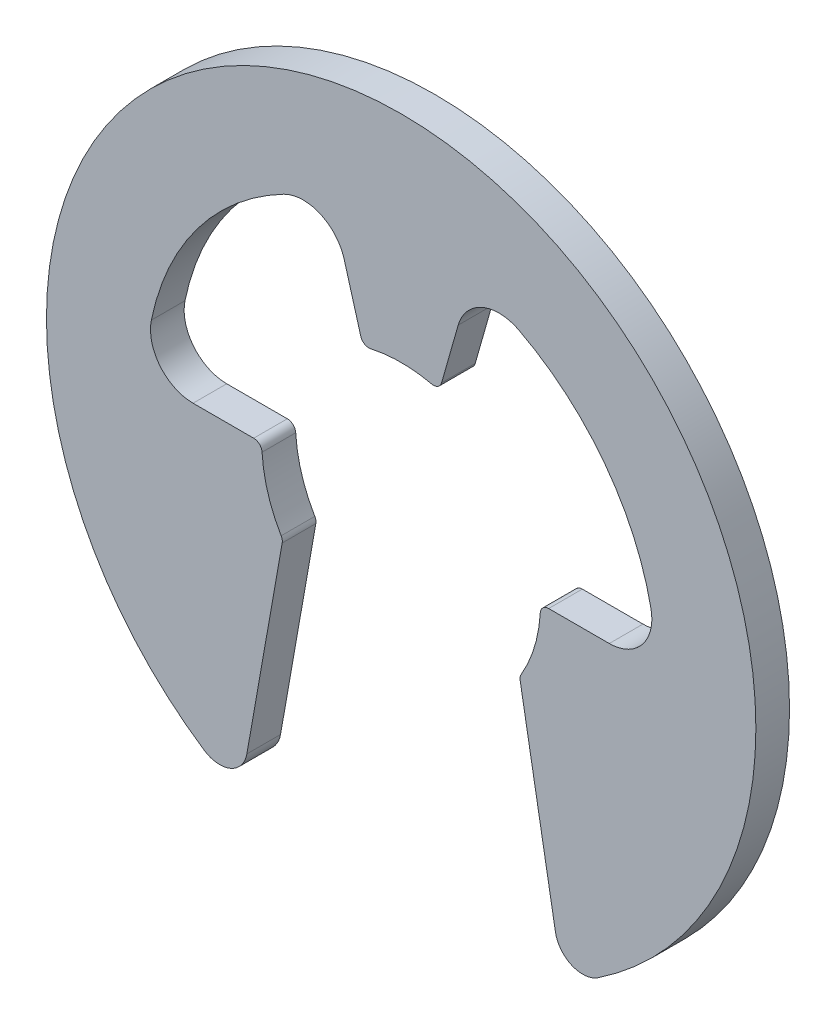
from build123d import *

# Parameters (mm, degrees)
SKETCH3_W               = 6.6929
SKETCH3_H               = 0.635
CUT_EXTRUDE1_DEPTH      = 10.470513559
CUT_EXTRUDE1_DEPTH_BACK = 10.470513559
FILLET1_R               = 0.803148
FILLET2_R               = 0.5220462
FILLET3_R               = 0.15875


with BuildPart() as part:
    # Sketch3 → Revolve1 (revolve)
    with BuildSketch(Plane(origin=(0, 0, 0), x_dir=(1, 0, 0), z_dir=(0, 1, 0))):
        with Locations((-3.34645, 0)):
            Rectangle(SKETCH3_W, SKETCH3_H)
    revolve(axis=Axis((0, 0, -0.3175), (0, 0, 1)))

    # Sketch4 → Cut-Extrude1 (cut, two sides: drawn at the far end of the back side and taken through both)
    with BuildSketch(Plane.XY.offset(-CUT_EXTRUDE1_DEPTH_BACK)):
        with BuildLine():
            Line((0.719953916, 2.528395058), (1.317615519, 4.62731363))
            ThreePointArc((1.317615519, 4.62731363), (3.839760531, 2.89903107), (4.811251613, 0))
            Line((4.811251613, 0), (2.6289, 0))
            ThreePointArc((2.6289, 0), (2.528395058, -0.719953916), (2.234565, -1.384859008))
            Line((2.234565, -1.384859008), (3.041609986, -5.961838567))
            ThreePointArc((3.041609986, -5.961838567), (0, -6.6929), (-3.041609986, -5.961838567))
            Line((-3.041609986, -5.961838567), (-2.234565, -1.384859008))
            ThreePointArc((-2.234565, -1.384859008), (-2.528395058, -0.719953916), (-2.6289, 0))
            Line((-2.6289, 0), (-4.811251613, 0))
            ThreePointArc((-4.811251613, 0), (-3.839760531, 2.89903107), (-1.317615519, 4.62731363))
            Line((-1.317615519, 4.62731363), (-0.719953916, 2.528395058))
            ThreePointArc((-0.719953916, 2.528395058), (0, 2.6289), (0.719953916, 2.528395058))
        make_face()
    extrude(amount=CUT_EXTRUDE1_DEPTH + CUT_EXTRUDE1_DEPTH_BACK, mode=Mode.SUBTRACT)

    # Fillet1
    fillet1_edges = [part.edges().sort_by_distance(p)[0] for p in [
        (1.317615519, 4.62731363, 0),
        (4.811251613, 0, 0),
        (-4.811251613, 0, 0),
        (-1.317615519, 4.62731363, 0),
    ]]
    fillet(fillet1_edges, radius=FILLET1_R)

    # Fillet2
    fillet2_edges = [part.edges().sort_by_distance(p)[0] for p in [
        (3.041609986, -5.961838567, 0),
        (-3.041609986, -5.961838567, 0),
    ]]
    fillet(fillet2_edges, radius=FILLET2_R)

    # Fillet3
    fillet3_edges = [part.edges().sort_by_distance(p)[0] for p in [
        (-0.719953916, 2.528395058, 0),
        (0.719953916, 2.528395058, 0),
        (2.6289, 0, 0),
        (2.234565, -1.384859008, 0),
        (-2.234565, -1.384859008, 0),
        (-2.6289, 0, 0),
    ]]
    fillet(fillet3_edges, radius=FILLET3_R)


solid = part.part
